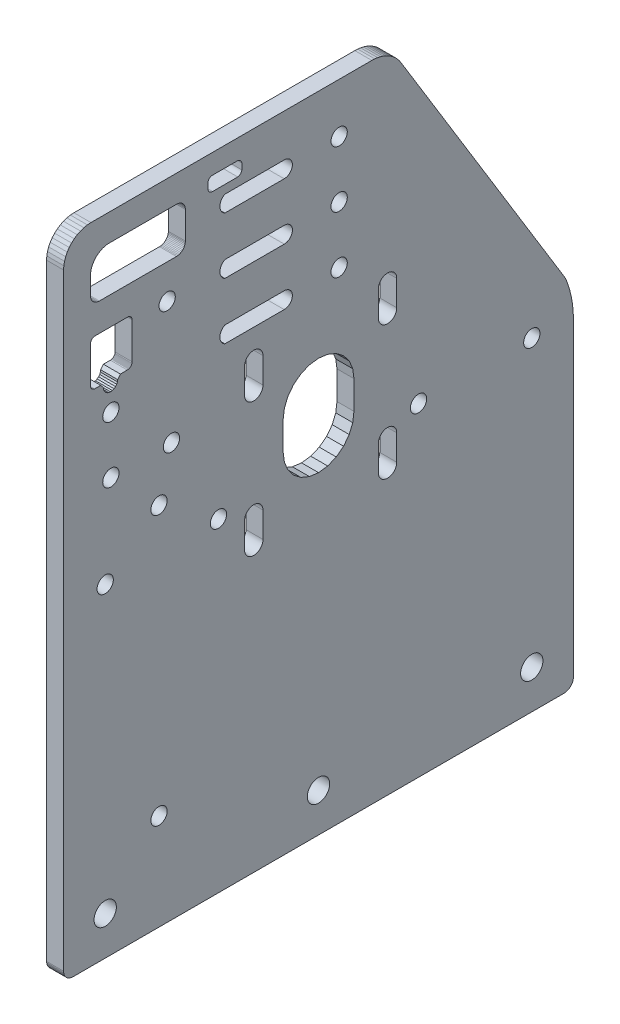
from build123d import *

# Parameters (mm, degrees)
SKETCH1_R           = 3.9435
SKETCH1_R_2         = 2.875
BOSS_EXTRUDE1_DEPTH = 6


with BuildPart() as part:
    # Sketch1 → Boss-Extrude1 (new body)
    with BuildSketch(Plane(origin=(0, 0, 0), x_dir=(0, -1, 0), z_dir=(-1, 0, 0))):
        Polygon((-590.212112636, -1614.243728334), (-495.230350852, -1672.335619946), (-492.985489602, -1673.198794727), (-490.688058814, -1673.910331453), (-488.34828871, -1674.467061724), (-485.976598042, -1674.866506478), (-483.583547703, -1675.10688703), (-481.179793697, -1675.18713299), (-371.826596113, -1675.18713299), (-371.387664827, -1675.158363913), (-370.956243777, -1675.072548931), (-370.539714696, -1674.931156361), (-370.145204514, -1674.736605469), (-369.779463407, -1674.492225074), (-369.448749309, -1674.202196594), (-369.158720829, -1673.871482496), (-368.914340435, -1673.50574139), (-368.719789543, -1673.111231207), (-368.578396973, -1672.694702127), (-368.49258199, -1672.263281077), (-368.463812914, -1671.82434979), (-368.463812914, -1498.50991619), (-368.49258199, -1498.070984903), (-368.578396973, -1497.639563853), (-368.719789543, -1497.223034773), (-368.914340435, -1496.82852459), (-369.158720829, -1496.462783484), (-369.448749309, -1496.132069386), (-369.779463407, -1495.842040906), (-370.145204514, -1495.597660511), (-370.539714696, -1495.403109619), (-370.956243777, -1495.261717049), (-371.387664827, -1495.175902067), (-371.826596113, -1495.14713299), (-586.288106544, -1495.145619765), (-587.549717355, -1495.228301598), (-588.789742622, -1495.474950056), (-589.98696498, -1495.881344878), (-591.12089944, -1496.440532473), (-592.172143895, -1497.142944902), (-593.122711102, -1497.976563587), (-593.956336446, -1498.927124952), (-594.658756242, -1499.978364486), (-595.217951782, -1501.112295027), (-595.624354993, -1502.309514537), (-595.87101214, -1503.549538076), (-595.953702813, -1504.811148308), (-595.953702813, -1603.994310614), (-595.910202971, -1605.015955139), (-595.780018321, -1606.030204482), (-595.564091204, -1607.029716989), (-595.263984611, -1608.007257681), (-594.881870865, -1608.955750621), (-594.420515902, -1609.868330136), (-593.883259242, -1610.738390509), (-593.273989822, -1611.559633802), (-592.597117845, -1612.326115438), (-591.857542854, -1613.032287234), (-591.060618269, -1613.673037558), align=None)
        with Locations(Location((-382.159118976, -1509.84713299, 0), (0, 0, 90))):
            Circle(SKETCH1_R, mode=Mode.SUBTRACT)
        with Locations(Location((-382.159118976, -1585.16713299, 0), (0, 0, 90))):
            Circle(SKETCH1_R, mode=Mode.SUBTRACT)
        with Locations(Location((-382.159118976, -1660.48713299, 0), (0, 0, 90))):
            Circle(SKETCH1_R, mode=Mode.SUBTRACT)
        with Locations(Location((-538.399280751, -1592.457817223, 0), (0, 0, 90))):
            Circle(SKETCH1_R_2, mode=Mode.SUBTRACT)
        with Locations(Location((-558.44846865, -1592.457817223, 0), (0, 0, 90))):
            Circle(SKETCH1_R_2, mode=Mode.SUBTRACT)
        with Locations(Location((-578.44846865, -1592.457817223, 0), (0, 0, 90))):
            Circle(SKETCH1_R_2, mode=Mode.SUBTRACT)
        with Locations(Location((-534.443559506, -1511.847133017, 0), (0, 0, 90))):
            Circle(SKETCH1_R_2, mode=Mode.SUBTRACT)
        with Locations(Location((-558.402442437, -1531.722977175, 0), (0, 0, 90))):
            Circle(SKETCH1_R_2, mode=Mode.SUBTRACT)
        with Locations(Location((-514.443559639, -1511.847132679, 0), (0, 0, 90))):
            Circle(SKETCH1_R_2, mode=Mode.SUBTRACT)
        with Locations(Location((-514.443559639, -1533.238984755, 0), (0, 0, 90))):
            Circle(SKETCH1_R_2, mode=Mode.SUBTRACT)
        with Locations(Location((-497.496167838, -1528.847132988, 0), (0, 0, 90))):
            Circle(SKETCH1_R_2, mode=Mode.SUBTRACT)
        with Locations(Location((-482.799118976, -1549.84713299, 0), (0, 0, 90))):
            Circle(SKETCH1_R_2, mode=Mode.SUBTRACT)
        with Locations(Location((-482.799118976, -1509.84713299, 0), (0, 0, 90))):
            Circle(SKETCH1_R_2, mode=Mode.SUBTRACT)
        with Locations(Location((-482.799118976, -1620.48713299, 0), (0, 0, 90))):
            Circle(SKETCH1_R_2, mode=Mode.SUBTRACT)
        with Locations(Location((-482.799118977, -1660.487132991, 0), (0, 0, 90))):
            Circle(SKETCH1_R_2, mode=Mode.SUBTRACT)
        with Locations(Location((-402.49616799, -1528.847132989, 0), (0, 0, 90))):
            Circle(SKETCH1_R_2, mode=Mode.SUBTRACT)
        with BuildLine():
            Line((-575.227783856, -1552.077882346), (-575.227783856, -1573.050634137))
            ThreePointArc((-575.227783856, -1573.050634137), (-578.079074753, -1575.949243679), (-580.977684295, -1573.097952782))
            Line((-580.977684295, -1573.097952782), (-580.977684295, -1552.084054231))
            ThreePointArc((-580.977684295, -1552.084054231), (-578.104595793, -1550.346540241), (-575.227783856, -1552.077882346))
        make_face(mode=Mode.SUBTRACT)
        with BuildLine():
            Line((-535.227816062, -1552.079240506), (-535.227816062, -1573.051992297))
            ThreePointArc((-535.227816062, -1573.051992297), (-538.07910696, -1575.950601839), (-540.977716502, -1573.099310942))
            Line((-540.977716502, -1573.099310942), (-540.977716502, -1552.085412391))
            ThreePointArc((-540.977716502, -1552.085412391), (-538.104627999, -1550.347898401), (-535.227816062, -1552.079240506))
        make_face(mode=Mode.SUBTRACT)
        with BuildLine():
            Line((-555.227626311, -1552.095047321), (-555.227626311, -1573.081416036))
            ThreePointArc((-555.227626311, -1573.081416036), (-558.086800371, -1575.972249955), (-560.977634291, -1573.113075895))
            Line((-560.977634291, -1573.113075895), (-560.977634291, -1552.099177304))
            ThreePointArc((-560.977634291, -1552.099177304), (-558.103876091, -1550.362649304), (-555.227626311, -1552.095047321))
        make_face(mode=Mode.SUBTRACT)
        with BuildLine():
            Line((-524.913709892, -1559.055192962), (-515.913733671, -1559.055192962))
            ThreePointArc((-515.913733671, -1559.055192962), (-512.663733671, -1562.305192962), (-515.913733671, -1565.555192962))
            Line((-515.913733671, -1565.555192962), (-524.913709892, -1565.555192962))
            ThreePointArc((-524.913709892, -1565.555192962), (-528.163709892, -1562.305192962), (-524.913709892, -1559.055192962))
        make_face(mode=Mode.SUBTRACT)
        with BuildLine():
            Line((-524.913709892, -1606.299062763), (-515.913733671, -1606.299062763))
            ThreePointArc((-515.913733671, -1606.299062763), (-512.663733671, -1609.549062763), (-515.913733671, -1612.799062763))
            Line((-515.913733671, -1612.799062763), (-524.913709892, -1612.799062763))
            ThreePointArc((-524.913709892, -1612.799062763), (-528.163709892, -1609.549062763), (-524.913709892, -1606.299062763))
        make_face(mode=Mode.SUBTRACT)
        with BuildLine():
            Line((-477.66984009, -1606.299062763), (-468.669863869, -1606.299062763))
            ThreePointArc((-468.669863869, -1606.299062763), (-465.419863869, -1609.549062763), (-468.669863869, -1612.799062763))
            Line((-468.669863869, -1612.799062763), (-477.66984009, -1612.799062763))
            ThreePointArc((-477.66984009, -1612.799062763), (-480.91984009, -1609.549062763), (-477.66984009, -1606.299062763))
        make_face(mode=Mode.SUBTRACT)
        with BuildLine():
            Line((-477.669839463, -1559.052819647), (-468.669476173, -1559.055193064))
            ThreePointArc((-468.669476173, -1559.055193064), (-465.420333542, -1562.306049759), (-468.671190237, -1565.55519239))
            Line((-468.671190237, -1565.55519239), (-477.669847322, -1565.552819423))
            ThreePointArc((-477.669847322, -1565.552819423), (-480.918990289, -1562.302815607), (-477.669839463, -1559.052819647))
        make_face(mode=Mode.SUBTRACT)
        Polygon((-586.033555203, -1536.579108211), (-586.214987166, -1536.211200586), (-586.346845371, -1535.822758839), (-586.426873689, -1535.420429315), (-586.453702813, -1535.011095984), (-586.453702813, -1511.296236305), (-586.396818705, -1510.428352529), (-586.227139684, -1509.575318486), (-585.947569005, -1508.751729823), (-585.5628902, -1507.971678372), (-585.079685229, -1507.248511028), (-584.506221865, -1506.594601387), (-583.852312223, -1506.021138022), (-583.12914488, -1505.537933052), (-582.349093428, -1505.153254247), (-581.525504766, -1504.873683568), (-580.672470722, -1504.704004546), (-579.804586946, -1504.647120438), (-573.616888973, -1504.647120438), (-573.207555642, -1504.673949562), (-572.805226118, -1504.75397788), (-572.416784371, -1504.885836086), (-572.048876746, -1505.067268048), (-571.707798245, -1505.295169417), (-571.399384815, -1505.565640735), (-571.128913497, -1505.874054164), (-570.901012129, -1506.215132665), (-570.719580166, -1506.58304029), (-570.587721961, -1506.971482038), (-570.507693643, -1507.373811562), (-570.480864519, -1507.783144892), (-570.480864519, -1535.011095984), (-570.507693643, -1535.420429315), (-570.587721961, -1535.822758839), (-570.719580166, -1536.211200586), (-570.901012129, -1536.579108211), (-571.128913497, -1536.920186712), (-571.399384815, -1537.228600142), (-571.707798245, -1537.49907146), (-572.048876746, -1537.726972829), (-572.416784371, -1537.908404791), (-572.805226118, -1538.040262996), (-573.207555642, -1538.120291315), (-573.616888973, -1538.147120438), (-583.317678359, -1538.147120438), (-583.72701169, -1538.120291315), (-584.129341214, -1538.040262996), (-584.517782961, -1537.908404791), (-584.885690586, -1537.726972828), (-585.226769087, -1537.49907146), (-585.535182516, -1537.228600142), (-585.805653835, -1536.920186712), align=None, mode=Mode.SUBTRACT)
        Polygon((-560.539732338, -1505.878268758), (-560.469558584, -1505.671543545), (-560.373002121, -1505.475746407), (-560.251715057, -1505.294227488), (-560.107772647, -1505.130092628), (-559.943637786, -1504.986150218), (-559.762118868, -1504.864863154), (-559.56632173, -1504.768306692), (-559.359596516, -1504.698132937), (-559.131202133, -1504.647120439), (-558.927636825, -1504.641264366), (-548.4808636, -1504.645157132), (-545.881846575, -1504.645157132), (-545.667730411, -1504.687747485), (-545.461005198, -1504.757921239), (-545.26520806, -1504.854477702), (-545.083689141, -1504.975764766), (-544.919554281, -1505.119707176), (-544.775611871, -1505.283842037), (-544.654324807, -1505.465360956), (-544.557768344, -1505.661158094), (-544.48759459, -1505.867883307), (-544.445004238, -1506.081999471), (-544.441434684, -1508.267709423), (-543.221041992, -1509.237688263), (-542.573960137, -1509.322613597), (-541.970907354, -1509.572122279), (-541.452980696, -1509.969210703), (-541.055476008, -1510.486817951), (-540.805482577, -1511.089669943), (-540.720037042, -1511.736683313), (-540.804962376, -1512.383765169), (-541.054471058, -1512.986817951), (-541.451559482, -1513.504744609), (-541.96916673, -1513.902249297), (-542.572018722, -1514.152242729), (-543.219032092, -1514.237688263), (-544.432285676, -1515.207667102), (-544.430726027, -1517.677645941), (-544.487594599, -1518.109605632), (-544.557768353, -1518.316330846), (-544.654324816, -1518.512127983), (-544.77561188, -1518.693646902), (-544.91955429, -1518.857781763), (-545.083689151, -1519.001724172), (-545.26520807, -1519.123011236), (-545.461005208, -1519.219567699), (-545.667730421, -1519.289741453), (-546.099691027, -1519.348570172), (-558.957839921, -1519.342717258), (-559.145480362, -1519.342717258), (-559.359596526, -1519.300126905), (-559.566321739, -1519.229953151), (-559.762118877, -1519.133396688), (-559.943637796, -1519.012109624), (-560.107772656, -1518.868167214), (-560.251715066, -1518.704032353), (-560.37300213, -1518.522513435), (-560.469558592, -1518.326716297), (-560.539732347, -1518.119991083), (-560.582322699, -1517.905874919), (-560.582322699, -1517.679609247), (-560.568044472, -1506.083962777), align=None, mode=Mode.SUBTRACT)
        Polygon((-512.609294248, -1578.937135138), (-510.622811466, -1576.348300373), (-508.033976701, -1574.36181759), (-505.019214764, -1573.113062308), (-501.7839767, -1572.687135137), (-491.783976402, -1572.687135137), (-488.548738338, -1573.113062308), (-485.533976401, -1574.36181759), (-482.945141636, -1576.348300373), (-480.958658854, -1578.937135138), (-479.709903572, -1581.951897074), (-479.283976401, -1585.187135138), (-479.709903572, -1588.422373202), (-480.958658854, -1591.437135139), (-482.945141636, -1594.025969904), (-485.533976401, -1596.012452687), (-488.548738338, -1597.261207968), (-491.783976402, -1597.68713514), (-501.7839767, -1597.68713514), (-505.019214764, -1597.261207968), (-508.033976701, -1596.012452687), (-510.622811466, -1594.025969904), (-512.609294248, -1591.437135139), (-513.85804953, -1588.422373202), (-514.283976701, -1585.187135138), (-513.85804953, -1581.951897074), align=None, mode=Mode.SUBTRACT)
        with BuildLine():
            Line((-588.98086362, -1556.648178727), (-588.98086362, -1547.550419842))
            ThreePointArc((-588.98086362, -1547.550419842), (-588.50376059, -1546.590680791), (-587.544021697, -1546.113577446))
            Line((-587.544021697, -1546.113577446), (-585.643575513, -1546.099299227))
            ThreePointArc((-585.643575513, -1546.099299227), (-584.463439705, -1546.588127429), (-583.974611428, -1547.768263206))
            Line((-583.974611428, -1547.768263206), (-583.988889647, -1556.648178564))
            ThreePointArc((-583.988889647, -1556.648178564), (-584.465992569, -1557.607917612), (-585.425731394, -1558.085020984))
            Line((-585.425731394, -1558.085020984), (-587.544021696, -1558.085020984))
            ThreePointArc((-587.544021696, -1558.085020984), (-588.506313615, -1557.610470755), (-588.98086362, -1556.648178727))
        make_face(mode=Mode.SUBTRACT)
    extrude(amount=-BOSS_EXTRUDE1_DEPTH)


solid = part.part
